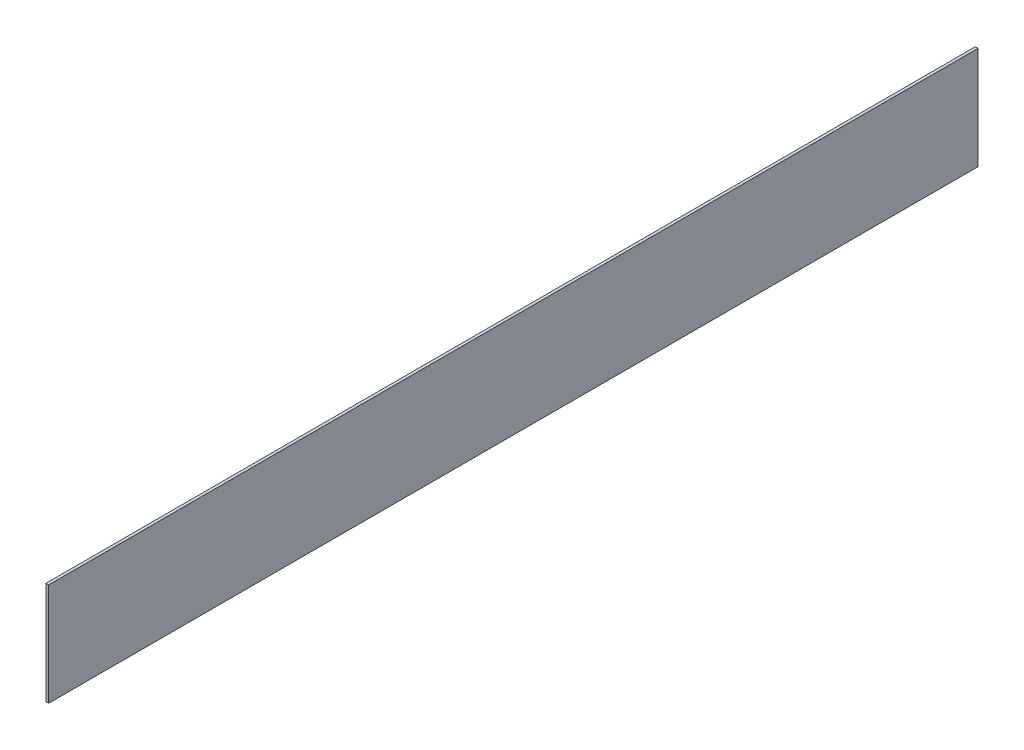
from build123d import *

# Parameters (mm, degrees)
SKETCH1_W           = 136
SKETCH1_H           = 15
BOSS_EXTRUDE1_DEPTH = 0.4


with BuildPart() as part:
    # Sketch1 → Boss-Extrude1 (new body)
    with BuildSketch(Plane(origin=(0, 0, 0), x_dir=(0, 0, -1), z_dir=(1, 0, 0))):
        Rectangle(SKETCH1_W, SKETCH1_H)
    extrude(amount=BOSS_EXTRUDE1_DEPTH)


solid = part.part
